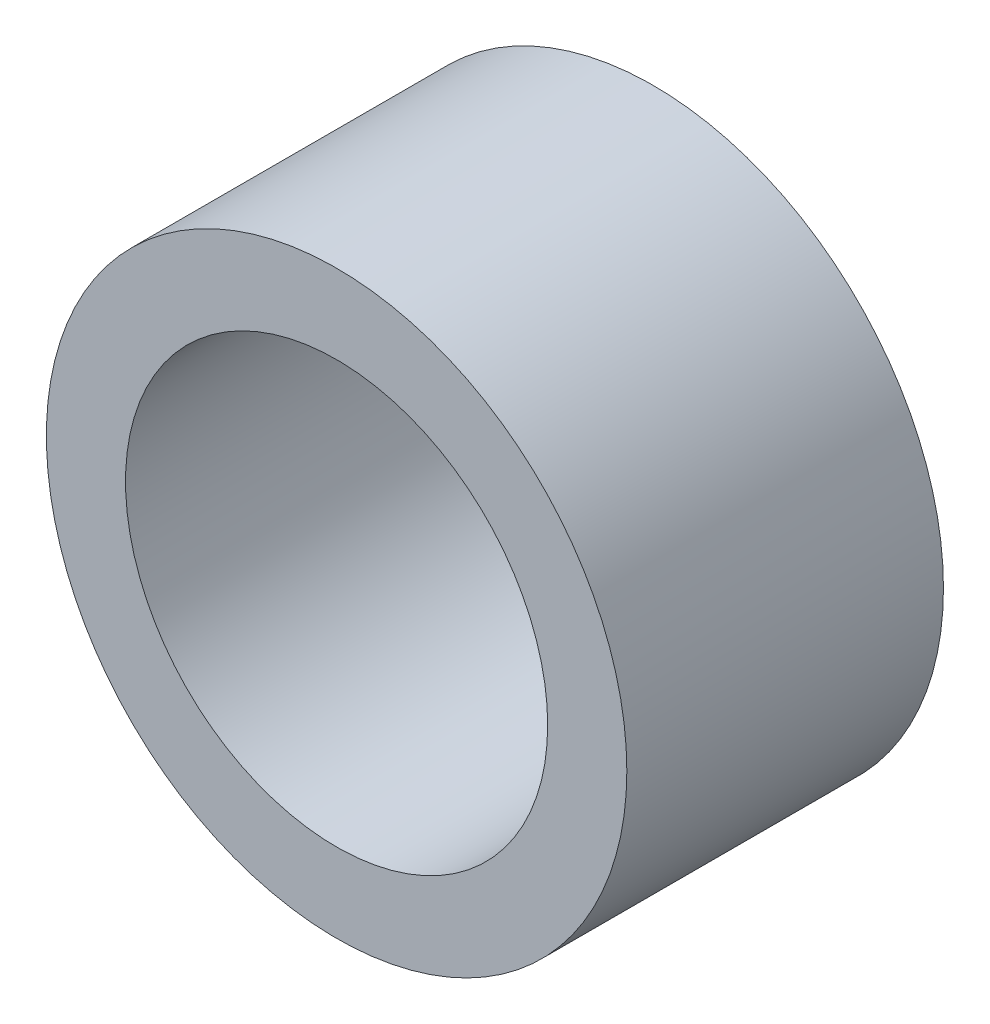
from build123d import *

# Parameters (mm, degrees)
SKETCH1_R           = 11
SKETCH1_R_2         = 8
BOSS_EXTRUDE1_DEPTH = 12


with BuildPart() as part:
    # Sketch1 → Boss-Extrude1 (new body)
    with BuildSketch(Plane.XY):
        Circle(SKETCH1_R)
        Circle(SKETCH1_R_2, mode=Mode.SUBTRACT)
    extrude(amount=BOSS_EXTRUDE1_DEPTH)


solid = part.part
